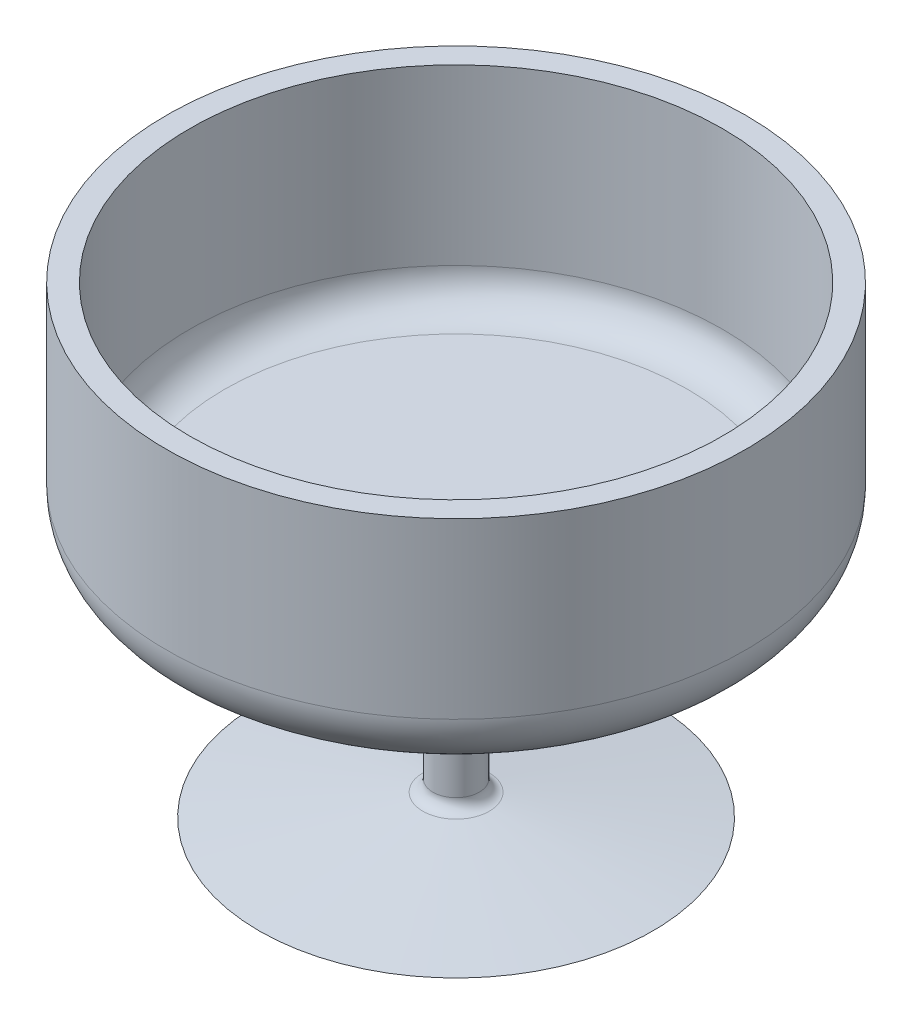
from build123d import *

# Parameters (mm, degrees)
FILLET_1_R = 5
FILLET_2_R = 1


with BuildPart() as part:
    # 草圖1 → 旋轉1 (revolve)
    with BuildSketch(Plane.XY, mode=Mode.PRIVATE) as revolve_1_sk:
        Polygon((0, 0), (0, 40), (25, 40), (25, 20), (2, 20), (2, 2), (17, 0), align=None)
    revolve(revolve_1_sk.sketch.rotate(Axis((0, 0, 0), (0, 1, 0)), 90), axis=Axis((0, 0, 0), (0, 1, 0)))

    # 圓角1
    fillet_1_edges = [part.edges().sort_by_distance(p)[0] for p in [
        (0, 20, 25),
    ]]
    fillet(fillet_1_edges, radius=FILLET_1_R)

    # 圓角2
    fillet_2_edges = [part.edges().sort_by_distance(p)[0] for p in [
        (0, 2, 2),
    ]]
    fillet(fillet_2_edges, radius=FILLET_2_R)

    # 草圖2 → 除料-旋轉1 (revolve, cut)
    with BuildSketch(Plane.XY, mode=Mode.PRIVATE) as cut_revolve_1_sk:
        with BuildLine():
            Line((23, 40), (0, 40))
            Line((0, 40), (0, 22))
            Line((0, 22), (20, 22))
            ThreePointArc((20, 22), (22.121320344, 22.878679656), (23, 25))
            Line((23, 25), (23, 40))
        make_face()
    revolve(cut_revolve_1_sk.sketch.rotate(Axis((0, 40, 0), (0, -1, 0)), 90), axis=Axis((0, 40, 0), (0, -1, 0)), mode=Mode.SUBTRACT)


solid = part.part
